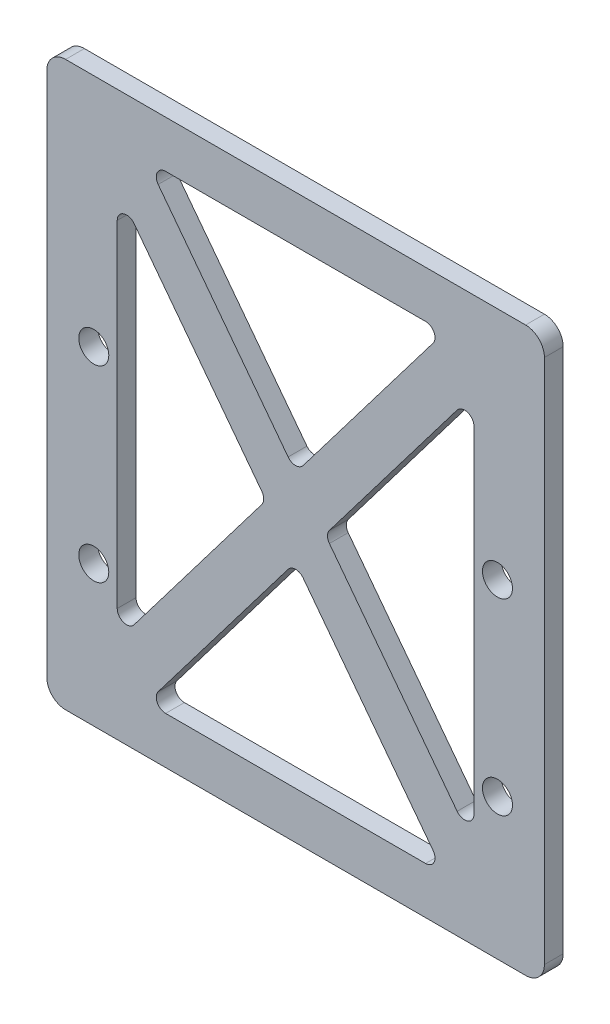
from build123d import *

# Parameters (mm, degrees)
SKETCH_1_W          = 53
SKETCH_1_H          = 60
EXTRUDE_1_DEPTH     = 2
FILLET_1_R          = 2
SKETCH_2_R          = 1.6
CUT_EXTRUDE_1_DEPTH = 41.078048855
CUT_EXTRUDE_2_DEPTH = 41.078048855
FILLET_2_R          = 1


with BuildPart() as part:
    # 草图1 → 凸台-拉伸1 (new body)
    with BuildSketch(Plane.XY):
        Rectangle(SKETCH_1_W, SKETCH_1_H)
    extrude(amount=EXTRUDE_1_DEPTH)

    # 圆角1
    fillet_1_edges = [part.edges().sort_by_distance(p)[0] for p in [
        (26.5, -30, 1),
        (-26.5, -30, 1),
        (-26.5, 30, 1),
        (26.5, 30, 1),
    ]]
    fillet(fillet_1_edges, radius=FILLET_1_R)

    # 草图2 → 切除-拉伸1 (cut, through all)
    with BuildSketch(Plane.XY.offset(2)):
        with Locations((21.5, 5)):
            Circle(SKETCH_2_R)
        with Locations((21.5, -15)):
            Circle(SKETCH_2_R)
        with Locations((-21.5, 5)):
            Circle(SKETCH_2_R)
        with Locations((-21.5, -15)):
            Circle(SKETCH_2_R)
    extrude(amount=-CUT_EXTRUDE_1_DEPTH, mode=Mode.SUBTRACT)

    # 草图3 → 切除-拉伸2 (cut, through all)
    with BuildSketch(Plane.XY.offset(2)):
        Polygon((-3.140063694, 0), (-19, 20.868337245), (-19, -20.868337245), align=None)
        Polygon((15.859936306, -25), (0, -4.131662755), (-15.859936306, -25), align=None)
        Polygon((19, 20.868337245), (3.140063694, 0), (19, -20.868337245), align=None)
        Polygon((15.859936306, 25), (-15.859936306, 25), (0, 4.131662755), align=None)
    extrude(amount=-CUT_EXTRUDE_2_DEPTH, mode=Mode.SUBTRACT)

    # 圆角2
    fillet_2_edges = [part.edges().sort_by_distance(p)[0] for p in [
        (3.140063694, 0, 1),
        (19, 20.868337245, 1),
        (19, -20.868337245, 1),
        (0, -4.131662755, 1),
        (15.859936306, -25, 1),
        (-15.859936306, -25, 1),
        (-15.859936306, 25, 1),
        (15.859936306, 25, 1),
        (0, 4.131662755, 1),
        (-19, 20.868337245, 1),
        (-3.140063694, 0, 1),
        (-19, -20.868337245, 1),
    ]]
    fillet(fillet_2_edges, radius=FILLET_2_R)


solid = part.part
